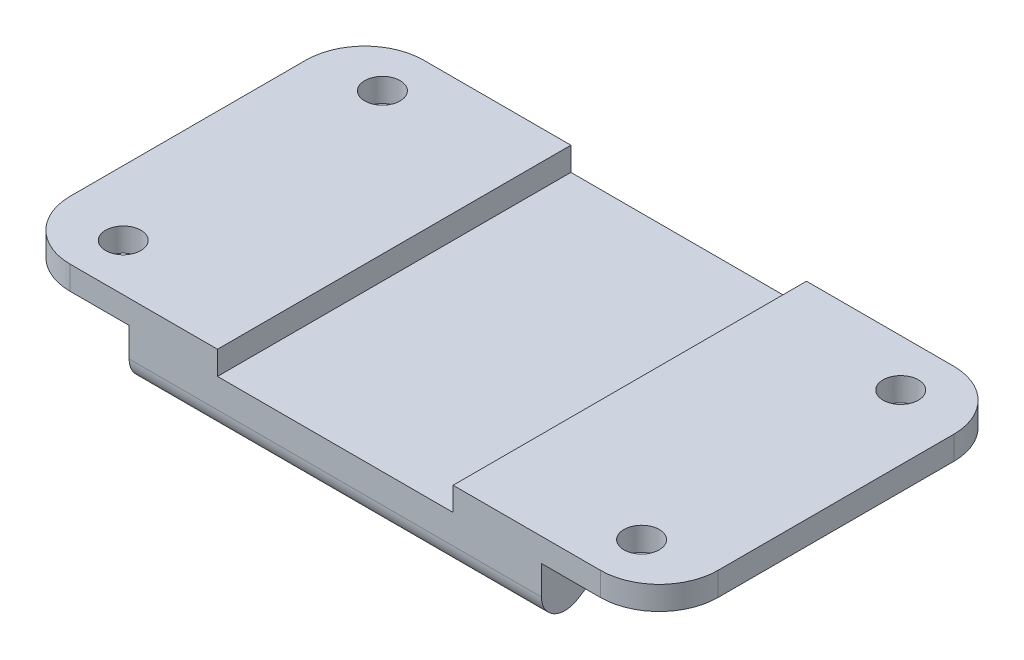
from build123d import *

# Parameters (mm, degrees)
SKETCH1_W               = 35
SKETCH1_H               = 30
BOSS_EXTRUDE1_DEPTH     = 8
CUT_EXTRUDE1_DEPTH      = 39.910152917
CUT_EXTRUDE1_DEPTH_BACK = 39.910152917
FILLET1_R               = 2
SKETCH5_W               = 30
SKETCH5_H               = 2
BOSS_EXTRUDE2_DEPTH     = 10
SKETCH6_R               = 1.5
CUT_EXTRUDE2_DEPTH      = 10
SKETCH3_W               = 10
SKETCH3_H               = 2
CUT_EXTRUDE3_DEPTH      = 42.207767455
FILLET3_R               = 5


with BuildPart() as part:
    # Sketch1 → Boss-Extrude1 (new body)
    with BuildSketch(Plane(origin=(0, 0, 0), x_dir=(1, 0, 0), z_dir=(0, 1, 0))):
        Rectangle(SKETCH1_W, SKETCH1_H)
    extrude(amount=-BOSS_EXTRUDE1_DEPTH)

    # Sketch2 → Cut-Extrude1 (cut, two sides: drawn at the far end of the back side and taken through both)
    with BuildSketch(Plane(origin=(17.5, 0, 0), x_dir=(0, 0, -1), z_dir=(1, 0, 0)).offset(-CUT_EXTRUDE1_DEPTH_BACK)):
        Polygon((-10, -5), (-15, -8), (0, -8), (0, -5), align=None)
        Polygon((0, -5), (0, -8), (15, -8), (10, -5), align=None)
    extrude(amount=CUT_EXTRUDE1_DEPTH + CUT_EXTRUDE1_DEPTH_BACK, mode=Mode.SUBTRACT)

    # Fillet1
    fillet1_edges = [part.edges().sort_by_distance(p)[0] for p in [
        (0, -8, -15),
        (0, -5, 10),
        (0, -5, -10),
        (0, -8, 15),
    ]]
    fillet(fillet1_edges, radius=FILLET1_R)

    # Sketch5 → Boss-Extrude2 (add)
    with BuildSketch(Plane.ZY.offset(17.5)):
        with Locations((0, -1)):
            Rectangle(SKETCH5_W, SKETCH5_H)
    boss_extrude2 = extrude(amount=BOSS_EXTRUDE2_DEPTH)

    # Mirror1: Boss-Extrude2 across plane
    add(boss_extrude2.mirror(Plane(origin=(0, 0, 0), x_dir=(0, 0, 1), z_dir=(1, 0, 0))))

    # Sketch6 → Cut-Extrude2 (cut)
    with BuildSketch(Plane(origin=(0, 0, 0), x_dir=(1, 0, 0), z_dir=(0, 1, 0))):
        with Locations(Location((-22, 11, 0), (0, 0, 270))):
            Circle(SKETCH6_R)
        with Locations(Location((-22, -11, 0), (0, 0, 270))):
            Circle(SKETCH6_R)
        with Locations(Location((22, -11, 0), (0, 0, 270))):
            Circle(SKETCH6_R)
        with Locations(Location((22, 11, 0), (0, 0, 270))):
            Circle(SKETCH6_R)
    extrude(amount=-CUT_EXTRUDE2_DEPTH, mode=Mode.SUBTRACT)

    # Sketch3 → Cut-Extrude3 (cut, through all)
    with BuildSketch(Plane.XY.offset(15)):
        with Locations((5, -1)):
            Rectangle(SKETCH3_W, SKETCH3_H)
        with Locations((-5, -1)):
            Rectangle(SKETCH3_W, SKETCH3_H)
    extrude(amount=-CUT_EXTRUDE3_DEPTH, mode=Mode.SUBTRACT)

    # Fillet3
    fillet3_edges = [part.edges().sort_by_distance(p)[0] for p in [
        (-27.5, -1, -15),
        (-27.5, -1, 15),
        (27.5, -1, -15),
        (27.5, -1, 15),
    ]]
    fillet(fillet3_edges, radius=FILLET3_R)


solid = part.part
